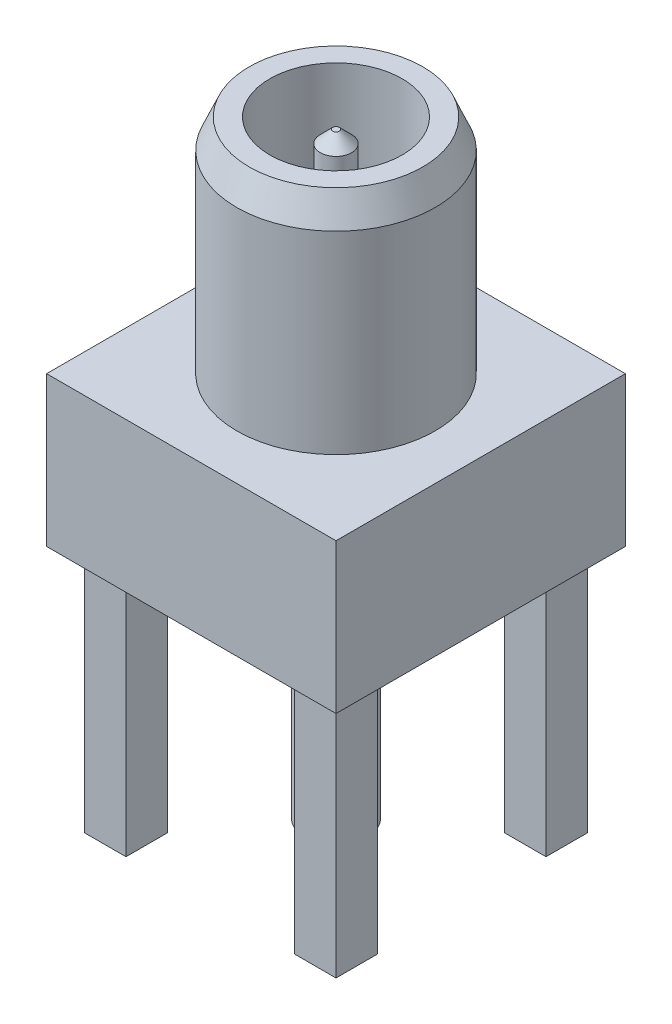
from build123d import *

# Parameters (mm, degrees)
SKETCH1_W           = 3.5
SKETCH1_H           = 3.5
BOSS_EXTRUDE1_DEPTH = 1.81
SKETCH2_W           = 0.5
SKETCH2_H           = 0.5
BOSS_EXTRUDE2_DEPTH = 3
SKETCH6_R           = 1
CUT_EXTRUDE1_DEPTH  = 0.001
SKETCH7_R           = 1.2
BOSS_EXTRUDE6_DEPTH = 2.69
HOLE1_D             = 1.6
HOLE1_DEPTH         = 1.45
CHAMFER3_SIZE       = 0.15
SKETCH12_R          = 0.381
BOSS_EXTRUDE7_DEPTH = 3.001
CHAMFER1_SIZE       = 0.15
CHAMFER2_SIZE       = 0.35
CHAMFER2_SIZE2      = 0.15


with BuildPart() as part:
    # Sketch1 → Boss-Extrude1 (new body)
    with BuildSketch(Plane.XZ):
        Rectangle(SKETCH1_W, SKETCH1_H)
    extrude(amount=-BOSS_EXTRUDE1_DEPTH)

    # Sketch2 → Boss-Extrude2 (add)
    with BuildSketch(Plane.XZ):
        with Locations((-1.27, -1.27)):
            Rectangle(SKETCH2_W, SKETCH2_H)
        with Locations((1.27, -1.27)):
            Rectangle(SKETCH2_W, SKETCH2_H)
        with Locations((1.27, 1.27)):
            Rectangle(SKETCH2_W, SKETCH2_H)
        with Locations((-1.27, 1.27)):
            Rectangle(SKETCH2_W, SKETCH2_H)
    extrude(amount=BOSS_EXTRUDE2_DEPTH)

    # Sketch6 → Cut-Extrude1 (cut)
    with BuildSketch(Plane.XZ):
        with Locations(Location((0, 0, 0), (0, 0, 90))):
            Circle(SKETCH6_R)
    extrude(amount=-CUT_EXTRUDE1_DEPTH, mode=Mode.SUBTRACT)

    # Sketch7 → Boss-Extrude6 (add)
    with BuildSketch(Plane(origin=(0, 1.81, 0), x_dir=(-1, 0, 0), z_dir=(0, 1, 0))):
        with Locations(Location((0, 0, 0), (0, 0, 270))):
            Circle(SKETCH7_R)
    extrude(amount=BOSS_EXTRUDE6_DEPTH)

    # Hole1
    with Locations(Plane(origin=(0, 4.5, 0), x_dir=(1, 0, 0), z_dir=(0, 1, 0))):
        with Locations((0, 0)):
            Hole(HOLE1_D / 2, depth=HOLE1_DEPTH)

    # Sketch10 → Revolve1 (revolve)
    with BuildSketch(Plane(origin=(0, 0, 0), x_dir=(-1, 0, 0), z_dir=(0, 0, -1)), mode=Mode.PRIVATE) as revolve1_sk:
        Polygon((-0.19, 3.05), (0, 3.05), (0, 4.37), (-0.0405, 4.37), (-0.19, 4.37), (-0.19, 4.220000833), align=None)
    revolve(revolve1_sk.sketch.rotate(Axis((0, 3.05, 0), (0, 1, 0)), 270), axis=Axis((0, 3.05, 0), (0, 1, 0)))

    # Chamfer3
    chamfer3_edges = [part.edges().sort_by_distance(p)[0] for p in [
        (0, 4.37, -0.19),
    ]]
    chamfer(chamfer3_edges, length=CHAMFER3_SIZE)

    # Sketch12 → Boss-Extrude7 (add)
    with BuildSketch(Plane.XZ.offset(-0.001)):
        with Locations(Location((0, 0, 0), (0, 0, 90))):
            Circle(SKETCH12_R)
    extrude(amount=BOSS_EXTRUDE7_DEPTH)

    # Chamfer1
    chamfer1_edges = [part.edges().sort_by_distance(p)[0] for p in [
        (0, -3, -0.381),
    ]]
    chamfer(chamfer1_edges, length=CHAMFER1_SIZE)

    # Chamfer2
    chamfer2_edges = [part.edges().sort_by_distance(p)[0] for p in [
        (0, 4.5, 1.2),
    ]]
    chamfer2_side = [part.faces().sort_by_distance(p)[0] for p in [
        (0, 3.155, 1.2),
    ]]
    chamfer(chamfer2_edges, length=CHAMFER2_SIZE, length2=CHAMFER2_SIZE2, reference=chamfer2_side[0])


solid = part.part
